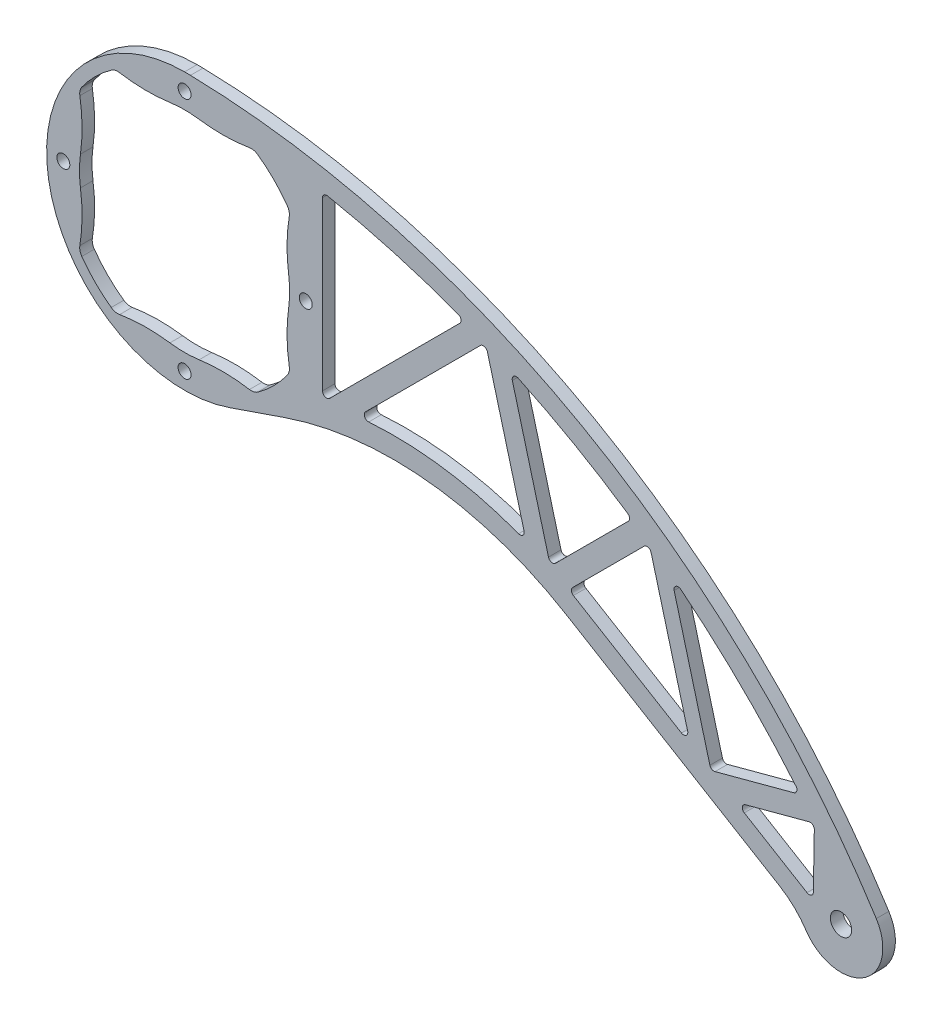
from build123d import *

# Parameters (mm, degrees)
SKETCH_2_R          = 1.55
EXTRUDE_1_DEPTH     = 3
SKETCH_7_R          = 2.55
CUT_EXTRUDE_2_DEPTH = 5
CUT_EXTRUDE_4_DEPTH = 184.170177924
CUT_EXTRUDE_5_DEPTH = 184.170177924


with BuildPart() as part:
    # 草图2 → 凸台-拉伸1 (new body)
    with BuildSketch(Plane.XY):
        with BuildLine():
            Line((10.730362356, -31.206719208), (23.987000349, -26.648453139))
            ThreePointArc((23.987000349, -26.648453139), (58.3964084, -22.742948884), (91.232460283, -33.745404185))
            Line((91.232460283, -33.745404185), (142.367635598, -64.500382059))
            ThreePointArc((142.367635598, -64.500382059), (145.885654628, -67.188078585), (148.726187194, -70.583891486))
            ThreePointArc((148.726187194, -70.583891486), (162.505343691, -73.443257489), (165.49953058, -59.692767585))
            ThreePointArc((165.49953058, -59.692767585), (95.05641772, 7.182197604), (1.414573065, 32.983322541))
            ThreePointArc((1.414573065, 32.983322541), (0.707335687, 32.99583049), (0, 33))
            ThreePointArc((0, 33), (-32.548592395, -5.439589421), (10.730362356, -31.206719208))
        make_face()
        with Locations((-29, 0)):
            Circle(SKETCH_2_R, mode=Mode.SUBTRACT)
        with Locations((0, 29)):
            Circle(SKETCH_2_R, mode=Mode.SUBTRACT)
        with Locations((0, -29)):
            Circle(SKETCH_2_R, mode=Mode.SUBTRACT)
        with Locations((29, 0)):
            Circle(SKETCH_2_R, mode=Mode.SUBTRACT)
        with BuildLine():
            ThreePointArc((-17.479158967, 24.504877103), (-21.283914114, 21.283914114), (-24.504877103, 17.479158967))
            ThreePointArc((-24.504877103, 17.479158967), (-24.920981627, 16.556612715), (-24.953330783, 15.545085111))
            ThreePointArc((-24.953330783, 15.545085111), (-24.421536801, 9.520350069), (-24.806472783, 3.484452336))
            ThreePointArc((-24.806472783, 3.484452336), (-25.05, 0), (-24.806472783, -3.484452336))
            ThreePointArc((-24.806472783, -3.484452336), (-24.421536801, -9.520350069), (-24.953330783, -15.545085111))
            ThreePointArc((-24.953330783, -15.545085111), (-24.920981627, -16.556612715), (-24.504877103, -17.479158967))
            ThreePointArc((-24.504877103, -17.479158967), (-21.283914114, -21.283914114), (-17.479158967, -24.504877103))
            ThreePointArc((-17.479158967, -24.504877103), (-16.556612715, -24.920981627), (-15.545085111, -24.953330783))
            ThreePointArc((-15.545085111, -24.953330783), (-9.520350069, -24.421536801), (-3.484452336, -24.806472783))
            ThreePointArc((-3.484452336, -24.806472783), (0, -25.05), (3.484452336, -24.806472783))
            ThreePointArc((3.484452336, -24.806472783), (9.520350069, -24.421536801), (15.545085111, -24.953330783))
            ThreePointArc((15.545085111, -24.953330783), (16.556612715, -24.920981627), (17.479158967, -24.504877103))
            ThreePointArc((17.479158967, -24.504877103), (21.283914114, -21.283914114), (24.504877103, -17.479158967))
            ThreePointArc((24.504877103, -17.479158967), (24.920981627, -16.556612715), (24.953330783, -15.545085111))
            ThreePointArc((24.953330783, -15.545085111), (24.421536801, -9.520350069), (24.806472783, -3.484452336))
            ThreePointArc((24.806472783, -3.484452336), (25.05, 0), (24.806472783, 3.484452336))
            ThreePointArc((24.806472783, 3.484452336), (24.421536801, 9.520350069), (24.953330783, 15.545085111))
            ThreePointArc((24.953330783, 15.545085111), (24.920981627, 16.556612715), (24.504877103, 17.479158967))
            ThreePointArc((24.504877103, 17.479158967), (21.283914114, 21.283914114), (17.479158967, 24.504877103))
            ThreePointArc((17.479158967, 24.504877103), (16.556612715, 24.920981627), (15.545085111, 24.953330783))
            ThreePointArc((15.545085111, 24.953330783), (9.520350069, 24.421536801), (3.484452336, 24.806472783))
            ThreePointArc((3.484452336, 24.806472783), (0, 25.05), (-3.484452336, 24.806472783))
            ThreePointArc((-3.484452336, 24.806472783), (-9.520350069, 24.421536801), (-15.545085111, 24.953330783))
            ThreePointArc((-15.545085111, 24.953330783), (-16.556612715, 24.920981627), (-17.479158967, 24.504877103))
        make_face(mode=Mode.SUBTRACT)
    extrude(amount=EXTRUDE_1_DEPTH)

    # 草图7 → 切除-拉伸2 (cut)
    with BuildSketch(Plane.XY.offset(3)):
        with Locations((157.059520527, -65.056183502)):
            Circle(SKETCH_7_R)
    extrude(amount=-CUT_EXTRUDE_2_DEPTH, mode=Mode.SUBTRACT)

    # 草图9 → 切除-拉伸4 (cut, through all)
    with BuildSketch(Plane.XY.offset(3)):
        with BuildLine():
            Line((33, 23.419217625), (33, -16.604240946))
            ThreePointArc((33, -16.604240946), (33.617316568, -17.528120479), (34.707106781, -17.311347728))
            Line((34.707106781, -17.311347728), (65.868650079, 13.85019557))
            ThreePointArc((65.868650079, 13.85019557), (66.139078304, 14.768075481), (65.514441307, 15.492964147))
            ThreePointArc((65.514441307, 15.492964147), (50.039622799, 20.601738513), (34.192271497, 24.400559396))
            ThreePointArc((34.192271497, 24.400559396), (33.364496852, 24.191315902), (33, 23.419217625))
        make_face()
        with BuildLine():
            Line((70.777272632, 11.687750311), (43.285444418, -15.804077902))
            ThreePointArc((43.285444418, -15.804077902), (43.082610213, -16.925922432), (44.062405255, -17.508741905))
            ThreePointArc((44.062405255, -17.508741905), (62.271705947, -18.191622153), (79.917026283, -22.739987506))
            ThreePointArc((79.917026283, -22.739987506), (80.940663068, -22.54482321), (81.234917124, -21.545155305))
            Line((81.234917124, -21.545155305), (72.450305239, 11.239462575))
            ThreePointArc((72.450305239, 11.239462575), (71.743198458, 11.946569356), (70.777272632, 11.687750311))
        make_face()
        with BuildLine():
            Line((78.420751264, 8.275971191), (87.070117002, -24.003901194))
            ThreePointArc((87.070117002, -24.003901194), (87.777223783, -24.711007975), (88.743149609, -24.45218893))
            Line((88.743149609, -24.45218893), (106.170669274, -7.024669265))
            ThreePointArc((106.170669274, -7.024669265), (106.459042033, -6.222586245), (106.024202869, -5.489503085))
            ThreePointArc((106.024202869, -5.489503085), (93.207654626, 2.482542409), (79.812900532, 9.439408155))
            ThreePointArc((79.812900532, 9.439408155), (78.745415788, 9.302112816), (78.420751264, 8.275971191))
        make_face()
        with BuildLine():
            Line((109.945638003, -10.320768348), (92.838490747, -27.427915604))
            ThreePointArc((92.838490747, -27.427915604), (92.553025259, -28.256678823), (93.030191775, -28.991968654))
            Line((93.030191775, -28.991968654), (118.888407737, -44.544254432))
            ThreePointArc((118.888407737, -44.544254432), (120.005457191, -44.486072744), (120.369739316, -43.428489117))
            Line((120.369739316, -43.428489117), (111.61867061, -10.769056085))
            ThreePointArc((111.61867061, -10.769056085), (110.911563829, -10.061949303), (109.945638003, -10.320768348))
        make_face()
        with BuildLine():
            Line((117.134569213, -15.899856701), (125.688599687, -47.823933039))
            ThreePointArc((125.688599687, -47.823933039), (126.154525513, -48.431139397), (126.913344559, -48.53103982))
            Line((126.913344559, -48.53103982), (145.779824835, -43.475781666))
            ThreePointArc((145.779824835, -43.475781666), (146.474470094, -42.811361762), (146.288127832, -41.868354653))
            ThreePointArc((146.288127832, -41.868354653), (133.176898235, -27.681248062), (118.726274243, -14.861037407))
            ThreePointArc((118.726274243, -14.861037407), (117.553950154, -14.803607846), (117.134569213, -15.899856701))
        make_face()
        with BuildLine():
            Line((149.412514403, -47.678786332), (134.175652373, -51.761491208))
            ThreePointArc((134.175652373, -51.761491208), (133.444233225, -52.588031523), (133.919065665, -53.584363304))
            Line((133.919065665, -53.584363304), (148.921539819, -62.607521196))
            ThreePointArc((148.921539819, -62.607521196), (149.921379935, -62.625402537), (150.436785689, -61.768456267))
            Line((150.436785689, -61.768456267), (150.671173564, -48.662593499))
            ThreePointArc((150.671173564, -48.662593499), (150.287163938, -47.856833482), (149.412514403, -47.678786332))
        make_face()
    extrude(amount=-CUT_EXTRUDE_4_DEPTH, mode=Mode.SUBTRACT)

    # 草图10 → 切除-拉伸5 (cut, through all)
    with BuildSketch(Plane.XY.offset(3)):
        with BuildLine():
            ThreePointArc((-3.498362326, -24.905500618), (-9.519132496, -24.521529388), (-15.52876795, -25.051990553))
            ThreePointArc((-15.52876795, -25.051990553), (-16.579200462, -25.018397199), (-17.537229262, -24.586288654))
            ThreePointArc((-17.537229262, -24.586288654), (-21.354624792, -21.354624792), (-24.586288654, -17.537229262))
            ThreePointArc((-24.586288654, -17.537229262), (-25.018397199, -16.579200462), (-25.051990553, -15.52876795))
            ThreePointArc((-25.051990553, -15.52876795), (-24.521529388, -9.519132496), (-24.905500618, -3.498362326))
            ThreePointArc((-24.905500618, -3.498362326), (-25.15, 0), (-24.905500618, 3.498362326))
            ThreePointArc((-24.905500618, 3.498362326), (-24.521529388, 9.519132496), (-25.051990553, 15.52876795))
            ThreePointArc((-25.051990553, 15.52876795), (-25.018397199, 16.579200462), (-24.586288654, 17.537229262))
            ThreePointArc((-24.586288654, 17.537229262), (-21.354624792, 21.354624792), (-17.537229262, 24.586288654))
            ThreePointArc((-17.537229262, 24.586288654), (-16.579200462, 25.018397199), (-15.52876795, 25.051990553))
            ThreePointArc((-15.52876795, 25.051990553), (-9.519132496, 24.521529388), (-3.498362326, 24.905500618))
            ThreePointArc((-3.498362326, 24.905500618), (0, 25.15), (3.498362326, 24.905500618))
            ThreePointArc((3.498362326, 24.905500618), (9.519132496, 24.521529388), (15.52876795, 25.051990553))
            ThreePointArc((15.52876795, 25.051990553), (16.579200462, 25.018397199), (17.537229262, 24.586288654))
            ThreePointArc((17.537229262, 24.586288654), (21.354624792, 21.354624792), (24.586288654, 17.537229262))
            ThreePointArc((24.586288654, 17.537229262), (25.018397199, 16.579200462), (25.051990553, 15.52876795))
            ThreePointArc((25.051990553, 15.52876795), (24.521529388, 9.519132496), (24.905500618, 3.498362326))
            ThreePointArc((24.905500618, 3.498362326), (25.15, 0), (24.905500618, -3.498362326))
            ThreePointArc((24.905500618, -3.498362326), (24.521529388, -9.519132496), (25.051990553, -15.52876795))
            ThreePointArc((25.051990553, -15.52876795), (25.018397199, -16.579200462), (24.586288654, -17.537229262))
            ThreePointArc((24.586288654, -17.537229262), (21.354624792, -21.354624792), (17.537229262, -24.586288654))
            ThreePointArc((17.537229262, -24.586288654), (16.579200462, -25.018397199), (15.52876795, -25.051990553))
            ThreePointArc((15.52876795, -25.051990553), (9.519132496, -24.521529388), (3.498362326, -24.905500618))
            ThreePointArc((3.498362326, -24.905500618), (0, -25.15), (-3.498362326, -24.905500618))
        make_face()
    extrude(amount=-CUT_EXTRUDE_5_DEPTH, mode=Mode.SUBTRACT)


solid = part.part
